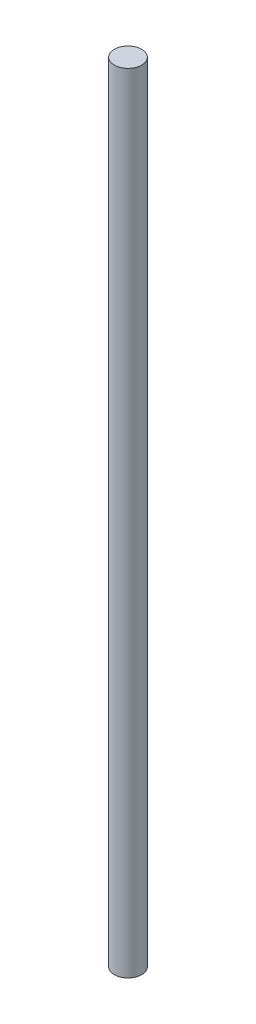
from build123d import *

# Parameters (mm, degrees)
SKETCH_1_R      = 4
EXTRUDE_2_DEPTH = 230


with BuildPart() as part:
    # 草图1 → 凸台-拉伸2 (new body)
    with BuildSketch(Plane(origin=(0, 0, 0), x_dir=(1, 0, 0), z_dir=(0, 1, 0))):
        with Locations(Location((0, 0, 0), (0, 0, 270))):
            Circle(SKETCH_1_R)
    extrude(amount=EXTRUDE_2_DEPTH)


solid = part.part
